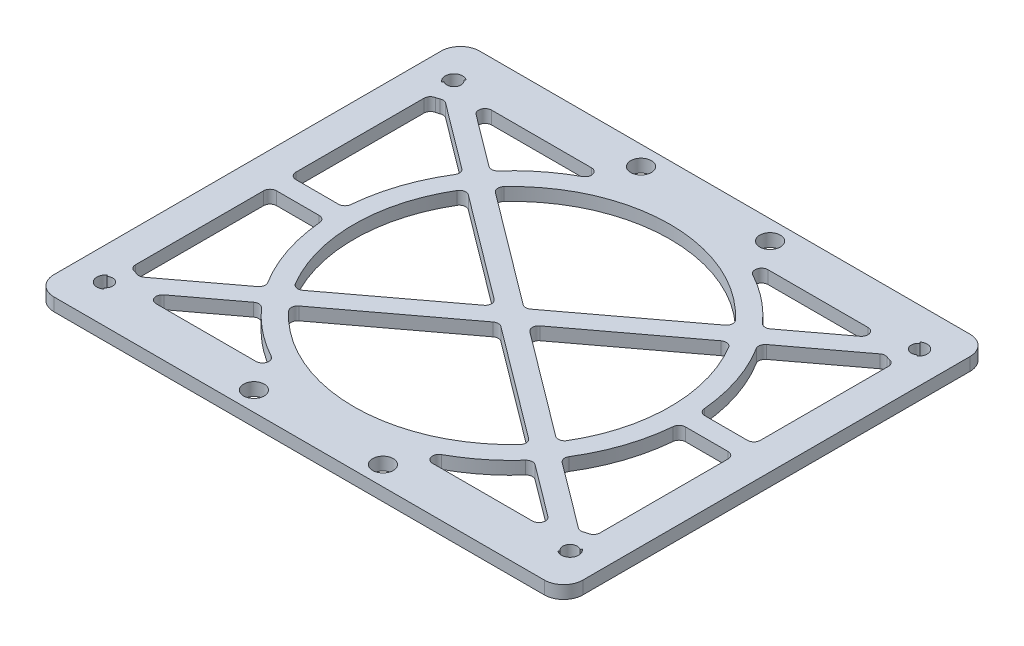
from build123d import *

# Parameters (mm, degrees)
SKETCH_1_W          = 82
SKETCH_1_H          = 66
SKETCH_1_R          = 1.6
SKETCH_1_R_2        = 1.35
EXTRUDE_1_DEPTH     = 2
FILLET_1_R          = 3
CUT_EXTRUDE_1_DEPTH = 10
SKETCH_3_R          = 27.5
SKETCH_3_R_2        = 24.5
SKETCH_3_W          = 10
SKETCH_3_H          = 3
EXTRUDE_1_2_DEPTH   = 2
SKETCH_4_R          = 1.1
CUT_EXTRUDE_2_DEPTH = 2
FILLET_2_R          = 1


with BuildPart() as part:
    # 草图1 → Extrude 1 (new body)
    with BuildSketch(Plane(origin=(0, 0, 0), x_dir=(1, 0, 0), z_dir=(0, 1, 0))):
        Rectangle(SKETCH_1_W, SKETCH_1_H)
        with Locations(Location((10, -30, 0), (0, 0, 270))):
            Circle(SKETCH_1_R, mode=Mode.SUBTRACT)
        with Locations(Location((-10, -30, 0), (0, 0, 270))):
            Circle(SKETCH_1_R, mode=Mode.SUBTRACT)
        with Locations(Location((-10, 30, 0), (0, 0, 270))):
            Circle(SKETCH_1_R, mode=Mode.SUBTRACT)
        with Locations(Location((10, 30, 0), (0, 0, 270))):
            Circle(SKETCH_1_R, mode=Mode.SUBTRACT)
        with Locations(Location((36, -27, 0), (0, 0, 270))):
            Circle(SKETCH_1_R_2, mode=Mode.SUBTRACT)
        with Locations(Location((36, 27, 0), (0, 0, 270))):
            Circle(SKETCH_1_R_2, mode=Mode.SUBTRACT)
        with Locations(Location((-36, 27, 0), (0, 0, 270))):
            Circle(SKETCH_1_R_2, mode=Mode.SUBTRACT)
        with Locations(Location((-36, -27, 0), (0, 0, 270))):
            Circle(SKETCH_1_R_2, mode=Mode.SUBTRACT)
    extrude(amount=EXTRUDE_1_DEPTH)

    # 圆角1
    fillet_1_edges = [part.edges().sort_by_distance(p)[0] for p in [
        (41, 1, 33),
        (-41, 1, 33),
        (-41, 1, -33),
        (41, 1, -33),
    ]]
    fillet(fillet_1_edges, radius=FILLET_1_R)

    # 草图2 → 切除-拉伸1 (cut)
    with BuildSketch(Plane(origin=(0, 2, 0), x_dir=(1, 0, 0), z_dir=(0, 1, 0))):
        with BuildLine():
            Line((32.385791926, 26), (-32.385791926, 26))
            ThreePointArc((-32.385791926, 26), (-33.729262234, 24.015665903), (-36, 23.25))
            Line((-36, 23.25), (-36, -23.25))
            ThreePointArc((-36, -23.25), (-33.729262234, -24.015665903), (-32.385791926, -26))
            Line((-32.385791926, -26), (32.385791926, -26))
            ThreePointArc((32.385791926, -26), (33.729262234, -24.015665903), (36, -23.25))
            Line((36, -23.25), (36, 23.25))
            ThreePointArc((36, 23.25), (33.729262234, 24.015665903), (32.385791926, 26))
        make_face()
    extrude(amount=-CUT_EXTRUDE_1_DEPTH, mode=Mode.SUBTRACT)

    # 草图3 → Extrude 1 2 (add)
    # profile 1 of 5: a face of its own
    with BuildSketch(Plane(origin=(0, 2, 0), x_dir=(1, 0, 0), z_dir=(0, 1, 0))):
        Circle(SKETCH_3_R)
        Circle(SKETCH_3_R_2, mode=Mode.SUBTRACT)
    # profile 2 of 5: a face of its own
    with BuildSketch(Plane(origin=(0, 2, 0), x_dir=(1, 0, 0), z_dir=(0, 1, 0))):
        Polygon((36.9, -25.8), (-35.1, 28.2), (-36.9, 25.8), (35.1, -28.2), align=None)
    # profile 3 of 5: a face of its own
    with BuildSketch(Plane(origin=(0, 2, 0), x_dir=(1, 0, 0), z_dir=(0, 1, 0))):
        Polygon((-35.1, -28.2), (36.9, 25.8), (35.1, 28.2), (-36.9, -25.8), align=None)
    # profile 4 of 5: a face of its own
    with BuildSketch(Plane(origin=(0, 2, 0), x_dir=(1, 0, 0), z_dir=(0, 1, 0))):
        with Locations((-31, 0)):
            Rectangle(SKETCH_3_W, SKETCH_3_H)
    # profile 5 of 5: a face of its own
    with BuildSketch(Plane(origin=(0, 2, 0), x_dir=(1, 0, 0), z_dir=(0, 1, 0))):
        with Locations((31, 0)):
            Rectangle(SKETCH_3_W, SKETCH_3_H)
    extrude(amount=-EXTRUDE_1_2_DEPTH)

    # 草图4 → 切除-拉伸2 (cut)
    with BuildSketch(Plane(origin=(0, 2, 0), x_dir=(1, 0, 0), z_dir=(0, 1, 0))):
        with Locations((36, 27)):
            Circle(SKETCH_4_R)
        with Locations((-36, 27)):
            Circle(SKETCH_4_R)
        with Locations((-36, -27)):
            Circle(SKETCH_4_R)
        with Locations((36, -27)):
            Circle(SKETCH_4_R)
    extrude(amount=-CUT_EXTRUDE_2_DEPTH, mode=Mode.SUBTRACT)

    # 圆角2
    fillet_2_edges = [part.edges().sort_by_distance(p)[0] for p in [
        (-34.150454583, 1, 23.737840937),
        (-8.958236434, 1, 26),
        (8.958236434, 1, 26),
        (-32.166666667, 1, 26),
        (32.166666667, 1, 26),
        (34.150454583, 1, 23.737840937),
        (34.150454583, 1, -23.737840937),
        (-8.958236434, 1, -26),
        (8.958236434, 1, -26),
        (32.166666667, 1, -26),
        (-32.166666667, 1, -26),
        (-34.150454583, 1, -23.737840937),
        (21.067248348, 1, 17.675436261),
        (-21.067248348, 1, 17.675436261),
        (0, 1, -1.875),
        (-18.663230817, 1, -15.872423113),
        (20.463230817, 1, 13.472423113),
        (0, 1, 1.875),
        (-22.867248348, 1, -15.275436261),
        (-22.867248348, 1, 15.275436261),
        (-27.459060435, 1, 1.5),
        (-36, 1, 1.5),
        (-27.459060435, 1, -1.5),
        (-36, 1, -1.5),
        (-20.463230817, 1, -13.472423113),
        (-20.463230817, 1, 13.472423113),
        (18.663230817, 1, 15.872423113),
        (-2.5, 1, 0),
        (-18.663230817, 1, 15.872423113),
        (2.5, 1, 0),
        (20.463230817, 1, -13.472423113),
        (21.067248348, 1, -17.675436261),
        (-21.067248348, 1, -17.675436261),
        (18.663230817, 1, -15.872423113),
        (22.867248348, 1, -15.275436261),
        (36, 1, 1.5),
        (27.459060435, 1, -1.5),
        (36, 1, -1.5),
        (22.867248348, 1, 15.275436261),
        (27.459060435, 1, 1.5),
        (-36, 1, -23.25),
        (36, 1, -23.25),
        (36, 1, 23.25),
        (-36, 1, 23.25),
    ]]
    fillet(fillet_2_edges, radius=FILLET_2_R)


solid = part.part
